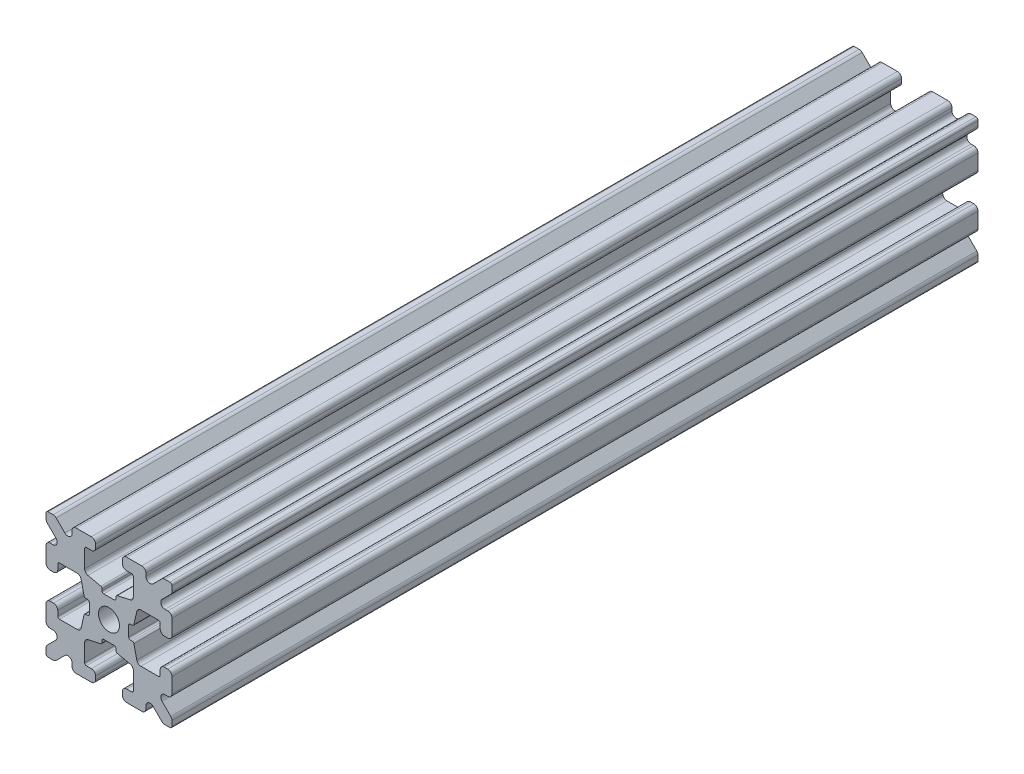
from build123d import *

# Parameters (mm, degrees)
SKETCH1_W           = 15
SKETCH1_H           = 15
SKETCH1_R           = 1.25
BOSS_EXTRUDE1_DEPTH = 48
FILLET1_R           = 0.25
CUT_EXTRUDE1_DEPTH  = 97.584160192
CUT_EXTRUDE3_DEPTH  = 97.584160192
FILLET3_R           = 0.5
FILLET4_R           = 0.5
FILLET5_R           = 3
FILLET6_R           = 0.2
CUT_EXTRUDE4_DEPTH  = 97.584160192
FILLET8_R           = 0.5
SKETCH6_W           = 5.1529354
SKETCH6_H           = 1.651
SKETCH6_W_2         = 1.651
SKETCH6_H_2         = 5.1529354
CUT_EXTRUDE5_DEPTH  = 97.584160192
FILLET10_R          = 0.2


with BuildPart() as part:
    # Sketch1 → Boss-Extrude1 (new, symmetric)
    with BuildSketch(Plane.XY):
        Rectangle(SKETCH1_W, SKETCH1_H)
        Circle(SKETCH1_R, mode=Mode.SUBTRACT)
    extrude(amount=BOSS_EXTRUDE1_DEPTH, both=True)

    # Fillet1
    fillet1_edges = [part.edges().sort_by_distance(p)[0] for p in [
        (7.5, -7.5, 0),
        (-7.5, -7.5, 0),
        (-7.5, 7.5, 0),
        (7.5, 7.5, 0),
    ]]
    fillet(fillet1_edges, radius=FILLET1_R)

    # Sketch2 → Cut-Extrude1 (cut, through all)
    with BuildSketch(Plane.XY.offset(48)):
        Polygon((-7.5, 1.6), (-6.1, 1.6), (-6.1, 2.9), (-3.4, 2.9), (-3.4, -2.9), (-6.1, -2.9), (-6.1, -1.6), (-7.5, -1.6), align=None)
        Polygon((2.9, 6.1), (1.6, 6.1), (1.6, 7.5), (-1.6, 7.5), (-1.6, 6.1), (-2.9, 6.1), (-2.9, 3.4), (2.9, 3.4), align=None)
        Polygon((-1.6, -7.5), (-1.6, -6.1), (-2.9, -6.1), (-2.9, -3.4), (2.9, -3.4), (2.9, -6.1), (1.6, -6.1), (1.6, -7.5), align=None)
        Polygon((6.1, -2.9), (6.1, -1.6), (7.5, -1.6), (7.5, 1.6), (6.1, 1.6), (6.1, 2.9), (3.4, 2.9), (3.4, -2.9), align=None)
    extrude(amount=-CUT_EXTRUDE1_DEPTH, mode=Mode.SUBTRACT)

    # Sketch4 → Cut-Extrude3 (cut, through all)
    with BuildSketch(Plane.XY.offset(48)):
        Polygon((-3.4, 2.9), (-2.75, 0), (-3.4, -2.9), align=None)
        Polygon((-2.9, 3.4), (0, 2.75), (2.9, 3.4), align=None)
        Polygon((3.4, 2.9), (2.75, 0), (3.4, -2.9), align=None)
        Polygon((-2.9, -3.4), (0, -2.75), (2.9, -3.4), align=None)
    extrude(amount=-CUT_EXTRUDE3_DEPTH, mode=Mode.SUBTRACT)

    # Fillet3
    fillet3_edges = [part.edges().sort_by_distance(p)[0] for p in [
        (1.6, -7.5, 0),
        (-1.6, -7.5, 0),
        (-1.6, -6.1, 0),
        (1.6, -6.1, 0),
        (6.1, 1.6, 0),
        (7.5, 1.6, 0),
        (7.5, -1.6, 0),
        (6.1, -1.6, 0),
        (-7.5, -1.6, 0),
        (-7.5, 1.6, 0),
        (-6.1, 1.6, 0),
        (-6.1, -1.6, 0),
        (-1.6, 6.1, 0),
        (-1.6, 7.5, 0),
        (1.6, 7.5, 0),
        (1.6, 6.1, 0),
    ]]
    fillet(fillet3_edges, radius=FILLET3_R)

    # Fillet4
    fillet4_edges = [part.edges().sort_by_distance(p)[0] for p in [
        (-2.9, -3.4, 0),
        (2.9, -3.4, 0),
        (3.4, -2.9, 0),
        (3.4, 2.9, 0),
        (-3.4, 2.9, 0),
        (-3.4, -2.9, 0),
        (2.9, 3.4, 0),
        (-2.9, 3.4, 0),
    ]]
    fillet(fillet4_edges, radius=FILLET4_R)

    # Fillet5
    fillet5_edges = [part.edges().sort_by_distance(p)[0] for p in [
        (-2.75, 0, 0),
        (0, 2.75, 0),
        (2.75, 0, 0),
        (0, -2.75, 0),
    ]]
    fillet(fillet5_edges, radius=FILLET5_R)

    # Fillet6
    fillet6_edges = [part.edges().sort_by_distance(p)[0] for p in [
        (-2.9, -6.1, 0),
        (2.9, -6.1, 0),
        (6.1, -2.9, 0),
        (6.1, 2.9, 0),
        (-6.1, 2.9, 0),
        (-6.1, -2.9, 0),
        (2.9, 6.1, 0),
        (-2.9, 6.1, 0),
    ]]
    fillet(fillet6_edges, radius=FILLET6_R)

    # Sketch5 → Cut-Extrude4 (cut, through all)
    with BuildSketch(Plane.XY.offset(48)):
        Polygon((-7.5, 6.439339828), (-5.460660172, 4.4), (-7.5, 4.4), align=None)
        Polygon((-6.439339828, 7.5), (-4.4, 5.460660172), (-4.4, 7.5), align=None)
        Polygon((4.4, 7.5), (6.439339828, 7.5), (4.4, 5.460660172), align=None)
        Polygon((7.5, 6.439339828), (7.5, 4.4), (5.460660172, 4.4), align=None)
        Polygon((7.5, -6.439339828), (5.460660172, -4.4), (7.5, -4.4), align=None)
        Polygon((6.439339828, -7.5), (4.4, -5.460660172), (4.4, -7.5), align=None)
        Polygon((-4.4, -7.5), (-6.439339828, -7.5), (-4.4, -5.460660172), align=None)
        Polygon((-7.5, -6.439339828), (-7.5, -4.4), (-5.460660172, -4.4), align=None)
    extrude(amount=-CUT_EXTRUDE4_DEPTH, mode=Mode.SUBTRACT)

    # Fillet8
    fillet8_edges = [part.edges().sort_by_distance(p)[0] for p in [
        (-7.5, 4.4, 0),
        (-7.5, 6.439339828, 0),
        (-5.460660172, 4.4, 0),
        (7.5, -4.4, 0),
        (7.5, -6.439339828, 0),
        (5.460660172, -4.4, 0),
        (5.460660172, 4.4, 0),
        (7.5, 6.439339828, 0),
        (7.5, 4.4, 0),
        (-4.4, 7.5, 0),
        (-4.4, 5.460660172, 0),
        (-6.439339828, 7.5, 0),
        (-5.460660172, -4.4, 0),
        (-7.5, -6.439339828, 0),
        (-7.5, -4.4, 0),
        (4.4, 5.460660172, 0),
        (4.4, 7.5, 0),
        (6.439339828, 7.5, 0),
        (6.439339828, -7.5, 0),
        (4.4, -7.5, 0),
        (4.4, -5.460660172, 0),
        (-6.439339828, -7.5, 0),
        (-4.4, -5.460660172, 0),
        (-4.4, -7.5, 0),
    ]]
    fillet(fillet8_edges, radius=FILLET8_R)

    # Sketch6 → Cut-Extrude5 (cut, through all)
    with BuildSketch(Plane.XY.offset(48)):
        with Locations((4.9235323, 0)):
            Rectangle(SKETCH6_W, SKETCH6_H)
        with Locations((0, -4.9235323)):
            Rectangle(SKETCH6_W_2, SKETCH6_H_2)
        with Locations((-4.9235323, 0)):
            Rectangle(SKETCH6_W, SKETCH6_H)
        with Locations((0, 4.9235323)):
            Rectangle(SKETCH6_W_2, SKETCH6_H_2)
    extrude(amount=-CUT_EXTRUDE5_DEPTH, mode=Mode.SUBTRACT)

    # Fillet10
    fillet10_edges = [part.edges().sort_by_distance(p)[0] for p in [
        (0.8255, -2.935025862, 0),
        (-0.8255, -2.935025862, 0),
        (0.8255, -2.3470646, 0),
        (-0.8255, -2.3470646, 0),
        (2.935025862, 0.8255, 0),
        (2.935025862, -0.8255, 0),
        (2.3470646, 0.8255, 0),
        (2.3470646, -0.8255, 0),
        (-2.935025862, -0.8255, 0),
        (-2.935025862, 0.8255, 0),
        (-2.3470646, -0.8255, 0),
        (-2.3470646, 0.8255, 0),
        (-0.8255, 2.935025862, 0),
        (0.8255, 2.935025862, 0),
        (-0.8255, 2.3470646, 0),
        (0.8255, 2.3470646, 0),
    ]]
    fillet(fillet10_edges, radius=FILLET10_R)


solid = part.part
